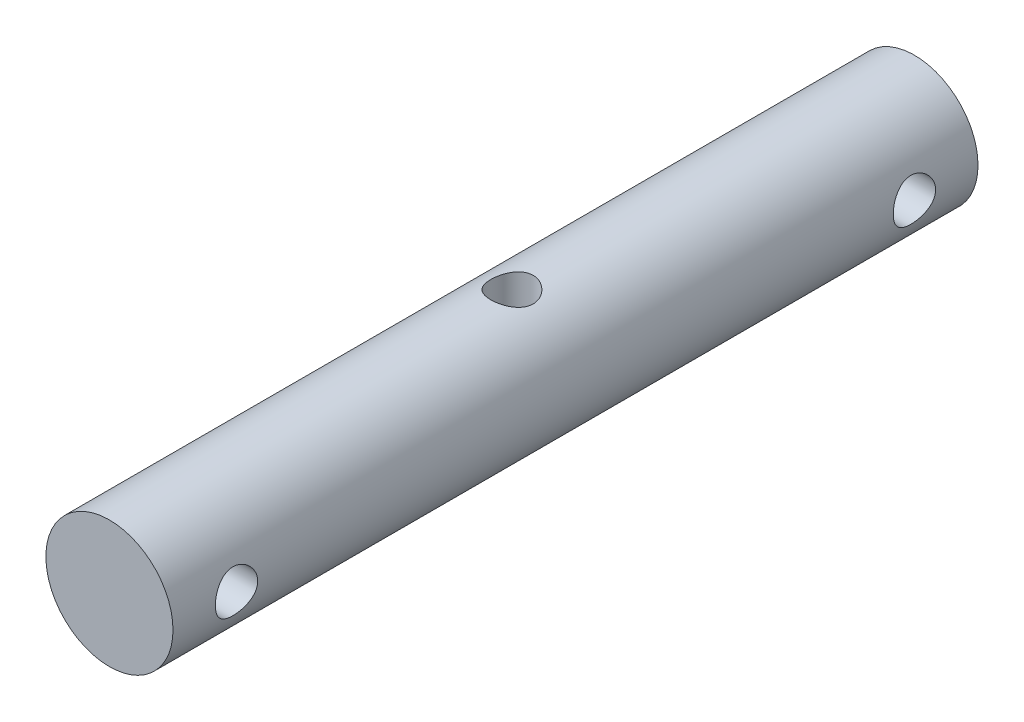
from build123d import *

# Parameters (mm, degrees)
SKETCH1_R           = 3
BOSS_EXTRUDE1_DEPTH = 38
SKETCH2_R           = 1
CUT_EXTRUDE3_DEPTH  = 19
SKETCH4_R           = 1
CUT_EXTRUDE4_DEPTH  = 19


with BuildPart() as part:
    # Sketch1 → Boss-Extrude1 (new body)
    with BuildSketch(Plane.XY):
        Circle(SKETCH1_R)
    extrude(amount=BOSS_EXTRUDE1_DEPTH)

    # Sketch2 → Cut-Extrude3 (cut, symmetric)
    with BuildSketch(Plane(origin=(0, 0, 0), x_dir=(1, 0, 0), z_dir=(0, 1, 0))):
        with Locations(Location((0, -19, 0), (0, 0, 270))):
            Circle(SKETCH2_R)
    extrude(amount=CUT_EXTRUDE3_DEPTH, both=True, mode=Mode.SUBTRACT)

    # Sketch4 → Cut-Extrude4 (cut, symmetric)
    with BuildSketch(Plane(origin=(0, 0, 0), x_dir=(0, 0, -1), z_dir=(1, 0, 0))):
        with Locations(Location((-35, 0, 0), (0, 0, 180))):
            Circle(SKETCH4_R)
        with Locations(Location((-3, 0, 0), (0, 0, 180))):
            Circle(SKETCH4_R)
    extrude(amount=CUT_EXTRUDE4_DEPTH, both=True, mode=Mode.SUBTRACT)


solid = part.part
